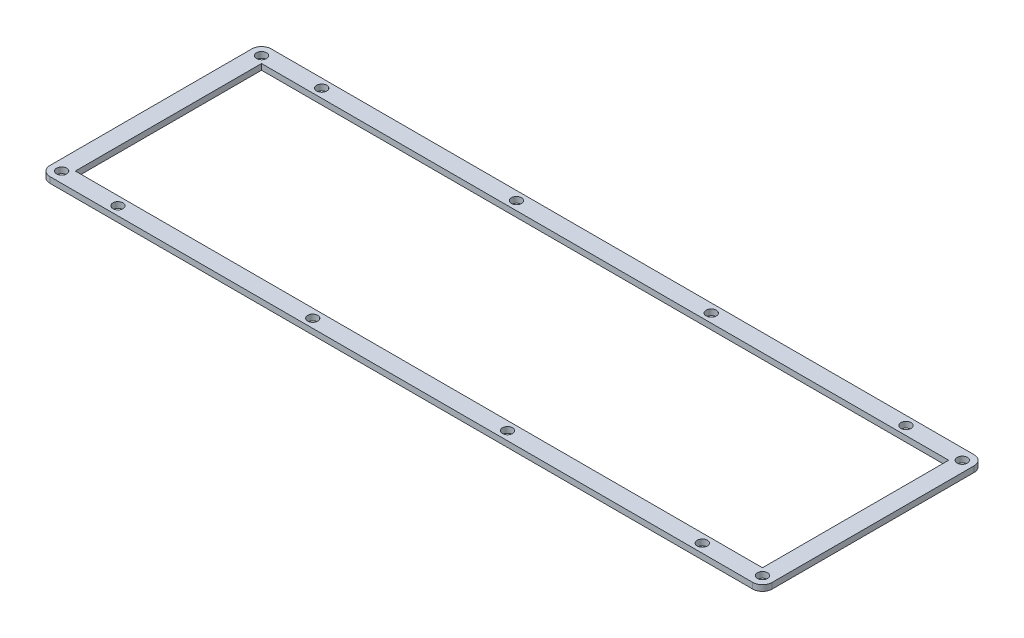
from build123d import *

# Parameters (mm, degrees)
SKETCH1_R           = 2.6
SKETCH1_W           = 352.775
SKETCH1_H           = 95.6
BOSS_EXTRUDE1_DEPTH = 3


with BuildPart() as part:
    # Sketch1 → Boss-Extrude1 (new body)
    with BuildSketch(Plane(origin=(0, 0, 0), x_dir=(1, 0, 0), z_dir=(0, 1, 0))):
        with BuildLine():
            Line((4.973e-06, 108.599998007), (4.973e-06, 4.999998007))
            ThreePointArc((4.973e-06, 4.999998007), (1.464471067, 1.464464101), (5.000004973, -1.993e-06))
            Line((5.000004973, -1.993e-06), (365.775004973, -1.993e-06))
            ThreePointArc((365.775004973, -1.993e-06), (369.310538879, 1.464464101), (370.775004973, 4.999998007))
            Line((370.775004973, 4.999998007), (370.775004973, 108.599998007))
            ThreePointArc((370.775004973, 108.599998007), (369.310538879, 112.135531913), (365.775004973, 113.599998007))
            Line((365.775004973, 113.599998007), (5.000004973, 113.599998007))
            ThreePointArc((5.000004973, 113.599998007), (1.464471067, 112.135531913), (4.973e-06, 108.599998007))
        make_face()
        with Locations(Location((5.500004973, 108.099998007, 0), (0, 0, 270))):
            Circle(SKETCH1_R, mode=Mode.SUBTRACT)
        with Locations(Location((5.500004973, 5.499998007, 0), (0, 0, 270))):
            Circle(SKETCH1_R, mode=Mode.SUBTRACT)
        with Locations(Location((365.275004973, 5.499998007, 0), (0, 0, 270))):
            Circle(SKETCH1_R, mode=Mode.SUBTRACT)
        with Locations(Location((365.275004973, 108.099998007, 0), (0, 0, 270))):
            Circle(SKETCH1_R, mode=Mode.SUBTRACT)
        with Locations(Location((35.387504973, 4.499998007, 0), (0, 0, 270))):
            Circle(SKETCH1_R, mode=Mode.SUBTRACT)
        with Locations(Location((135.387504973, 4.499998007, 0), (0, 0, 270))):
            Circle(SKETCH1_R, mode=Mode.SUBTRACT)
        with Locations(Location((335.387504973, 4.499998007, 0), (0, 0, 270))):
            Circle(SKETCH1_R, mode=Mode.SUBTRACT)
        with Locations(Location((235.387504973, 4.499998007, 0), (0, 0, 270))):
            Circle(SKETCH1_R, mode=Mode.SUBTRACT)
        with Locations(Location((35.387504973, 109.099998007, 0), (0, 0, 270))):
            Circle(SKETCH1_R, mode=Mode.SUBTRACT)
        with Locations(Location((135.387504973, 109.099998007, 0), (0, 0, 270))):
            Circle(SKETCH1_R, mode=Mode.SUBTRACT)
        with Locations(Location((335.387504973, 109.099998007, 0), (0, 0, 270))):
            Circle(SKETCH1_R, mode=Mode.SUBTRACT)
        with Locations(Location((235.387504973, 109.099998007, 0), (0, 0, 270))):
            Circle(SKETCH1_R, mode=Mode.SUBTRACT)
        with Locations((185.387504973, 56.799998007)):
            Rectangle(SKETCH1_W, SKETCH1_H, mode=Mode.SUBTRACT)
    extrude(amount=-BOSS_EXTRUDE1_DEPTH)


solid = part.part
